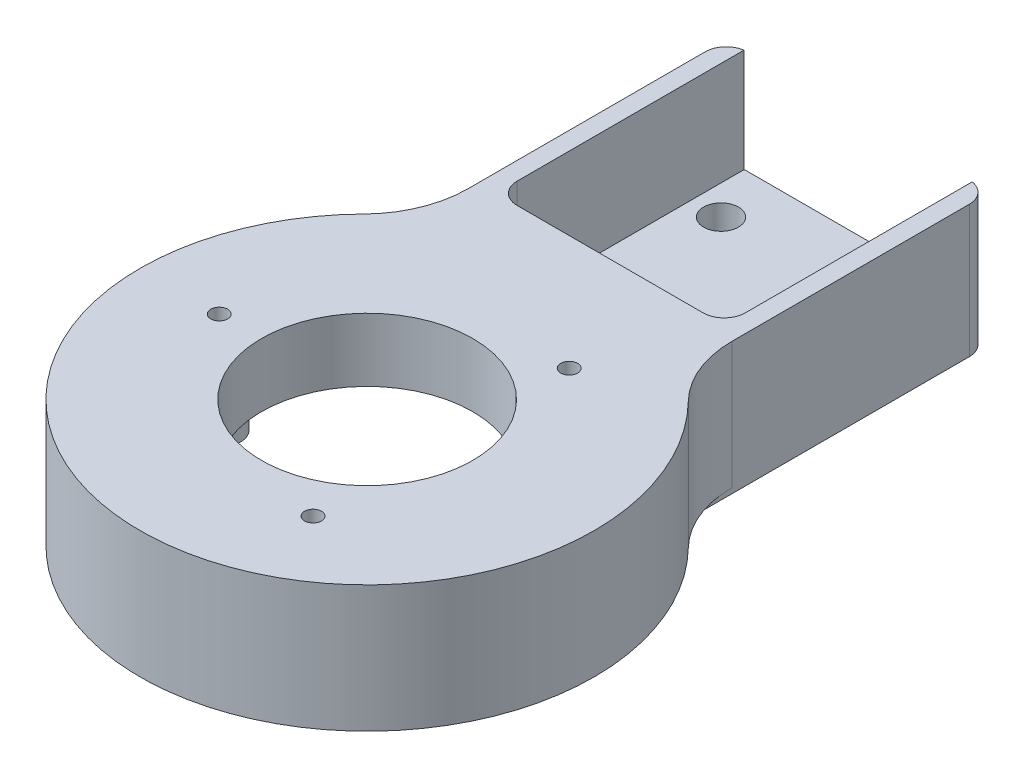
from build123d import *

# Parameters (mm, degrees)
SKETCH_1_R                   = 21.5
EXTRUDE_1_DEPTH              = 12
EXTRUDE_START                = -13.5
EXTRUDE_2_DEPTH              = 13.5
FILLET_1_R                   = 10
SKETCH_4_R                   = 20
CUT_EXTRUDE_1_DEPTH          = 6
SKETCH_5_R                   = 10
CUT_EXTRUDE_2_DEPTH          = 6
SKETCH_6_R                   = 2
EXTRUDE_3_DEPTH              = 3.5
HOLE_WIZARD_M2_1_D           = 1.6
HOLE_WIZARD_M2_1_CSINK_D     = 1.65
HOLE_WIZARD_M2_1_CSINK_ANGLE = 90
CUT_EXTRUDE_3_DEPTH          = 73.320467366
CUT_EXTRUDE_3_DEPTH_BACK     = 23.5
FILLET_2_R                   = 2
FILLET_3_R                   = 2
CHAMFER_1_SIZE               = 1
SKETCH_9_R                   = 1.65
CUT_EXTRUDE_4_DEPTH          = 23.5
CHAMFER_2_SIZE               = 1


with BuildPart() as part:
    # 草图1 → 凸台-拉伸1 (new body)
    with BuildSketch(Plane(origin=(0, 0, 0), x_dir=(1, 0, 0), z_dir=(0, 1, 0))):
        with Locations(Location((0, 0, 0), (0, 0, 270))):
            Circle(SKETCH_1_R)
    extrude(amount=EXTRUDE_1_DEPTH)

    # 草图3 → 凸台-拉伸2 (add)
    with BuildSketch(Plane(origin=(0, 12, 0), x_dir=(1, 0, 0), z_dir=(0, 1, 0)).offset(EXTRUDE_START)):
        with BuildLine():
            Line((-12.5, 46.5), (12.5, 46.5))
            Line((12.5, 46.5), (12.5, 17.492855685))
            ThreePointArc((12.5, 17.492855685), (0, 21.5), (-12.5, 17.492855685))
            Line((-12.5, 17.492855685), (-12.5, 46.5))
        make_face()
    extrude(amount=EXTRUDE_2_DEPTH)

    # 圆角1
    fillet_1_edges = [part.edges().sort_by_distance(p)[0] for p in [
        (12.5, 6, -17.492855685),
        (-12.5, 6, -17.492855685),
    ]]
    fillet(fillet_1_edges, radius=FILLET_1_R)

    # 草图4 → 切除-拉伸1 (cut)
    with BuildSketch(Plane(origin=(0, 0, 0), x_dir=(-1, 0, 0), z_dir=(0, -1, 0))):
        with Locations(Location((0, 0, 0), (0, 0, 90))):
            Circle(SKETCH_4_R)
    extrude(amount=-CUT_EXTRUDE_1_DEPTH, mode=Mode.SUBTRACT)

    # 草图5 → 切除-拉伸2 (cut)
    with BuildSketch(Plane(origin=(0, 6, 0), x_dir=(-1, 0, 0), z_dir=(0, -1, 0))):
        with Locations(Location((0, 0, 0), (0, 0, 90))):
            Circle(SKETCH_5_R)
    extrude(amount=-CUT_EXTRUDE_2_DEPTH, mode=Mode.SUBTRACT)

    # 草图6 → 凸台-拉伸3 (add)
    with BuildSketch(Plane(origin=(0, 6, 0), x_dir=(-1, 0, 0), z_dir=(0, -1, 0))):
        with Locations(Location((14, 0, 0), (0, 0, 90))):
            Circle(SKETCH_6_R)
        with Locations(Location((-7, -12.124355653, 0), (0, 0, 90))):
            Circle(SKETCH_6_R)
        with Locations(Location((-7, 12.124355653, 0), (0, 0, 90))):
            Circle(SKETCH_6_R)
    extrude(amount=EXTRUDE_3_DEPTH)

    # M2 螺纹孔的螺纹孔钻头1 (through all)
    with Locations(Plane(origin=(7, 2.5, 12.124355653), x_dir=(0, 0, -1), z_dir=(0, -1, 0))):
        with Locations((0, 0), (24.248711306, 0), (12.124355653, -21)):
            CounterSinkHole(HOLE_WIZARD_M2_1_D / 2, HOLE_WIZARD_M2_1_CSINK_D / 2, counter_sink_angle=HOLE_WIZARD_M2_1_CSINK_ANGLE)

    # 草图8 → 切除-拉伸3 (cut, two sides: drawn at the far end of the back side and taken through both)
    with BuildSketch(Plane(origin=(0, 0, -46.5), x_dir=(-1, 0, 0), z_dir=(0, 0, -1)).offset(-CUT_EXTRUDE_3_DEPTH_BACK)):
        Polygon((-10.8, 92.015426872), (-10.8, 12), (-10.8, 2.2), (10.8, 2.2), (10.8, 12), (10.8, 92.015426872), (10.8, 252.046280615), (-10.8, 252.046280615), align=None)
    extrude(amount=CUT_EXTRUDE_3_DEPTH + CUT_EXTRUDE_3_DEPTH_BACK, mode=Mode.SUBTRACT)

    # 圆角2
    fillet_2_edges = [part.edges().sort_by_distance(p)[0] for p in [
        (10.8, 7.1, -23),
        (-10.8, 7.1, -23),
    ]]
    fillet(fillet_2_edges, radius=FILLET_2_R)

    # 圆角3
    fillet_3_edges = [part.edges().sort_by_distance(p)[0] for p in [
        (12.5, 5.25, -46.5),
        (-12.5, 5.25, -46.5),
    ]]
    fillet(fillet_3_edges, radius=FILLET_3_R)

    # 倒角1
    chamfer_1_edges = [part.edges().sort_by_distance(p)[0] for p in [
        (0, -1.5, -46.5),
        (-12.5, -1.5, -30.996427842),
        (-11.914213562, -1.5, -45.914213562),
        (11.914213562, -1.5, -45.914213562),
        (12.5, -1.5, -30.996427842),
    ]]
    chamfer(chamfer_1_edges, length=CHAMFER_1_SIZE)

    # 草图9 → 切除-拉伸4 (cut)
    with BuildSketch(Plane(origin=(0, 2.2, 0), x_dir=(1, 0, 0), z_dir=(0, 1, 0))):
        with Locations(Location((-8, 41.5, 0), (0, 0, 270))):
            Circle(SKETCH_9_R)
        with Locations(Location((-8, 28.5, 0), (0, 0, 270))):
            Circle(SKETCH_9_R)
        with Locations(Location((8, 28.5, 0), (0, 0, 270))):
            Circle(SKETCH_9_R)
        with Locations(Location((8, 41.5, 0), (0, 0, 270))):
            Circle(SKETCH_9_R)
    extrude(amount=-CUT_EXTRUDE_4_DEPTH, mode=Mode.SUBTRACT)

    # 倒角2
    chamfer_2_edges = [part.edges().sort_by_distance(p)[0] for p in [
        (8, -1.5, -43.15),
        (8, -1.5, -30.15),
        (-8, -1.5, -30.15),
        (-8, -1.5, -43.15),
    ]]
    chamfer(chamfer_2_edges, length=CHAMFER_2_SIZE)


solid = part.part
